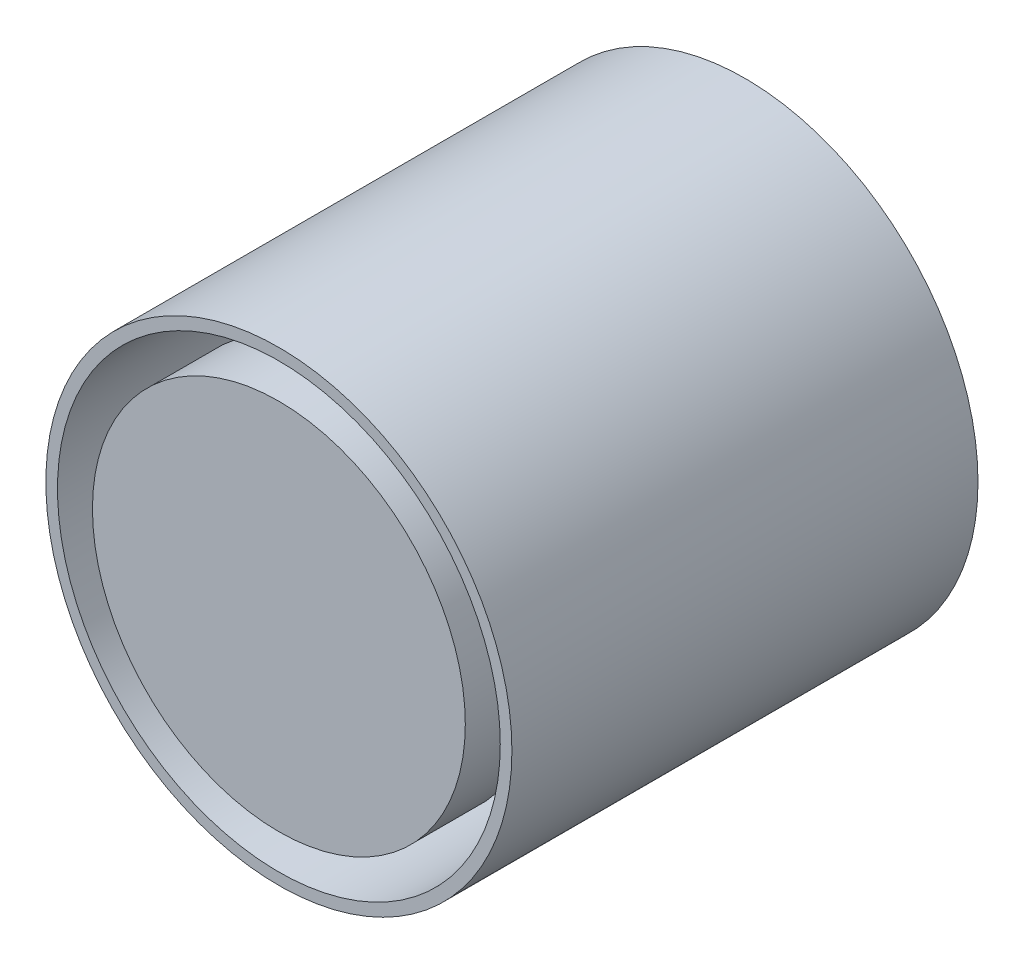
from build123d import *

# Parameters (mm, degrees)
SKETCH_2_R          = 100
EXTRUDE_2_DEPTH     = 200
SKETCH_3_R          = 95
CUT_EXTRUDE_1_DEPTH = 400
SKETCH_4_R          = 80
EXTRUDE_3_DEPTH     = 30


with BuildPart() as part:
    # 草图2 → 凸台-拉伸2 (new body)
    with BuildSketch(Plane.XY):
        Circle(SKETCH_2_R)
    extrude(amount=EXTRUDE_2_DEPTH)

    # 草图3 → 切除-拉伸1 (cut)
    with BuildSketch(Plane.XY.offset(200)):
        Circle(SKETCH_3_R)
    extrude(amount=-CUT_EXTRUDE_1_DEPTH, mode=Mode.SUBTRACT)


with BuildPart() as body_2:
    # 草图4 → 凸台-拉伸3 (new body)
    with BuildSketch(Plane(origin=(0, 0, 0), x_dir=(-1, 0, 0), z_dir=(0, 0, -1))):
        Circle(SKETCH_4_R)
    extrude(amount=-EXTRUDE_3_DEPTH)


with BuildPart() as body_2_1:
    # Move Body 3: moved
    add(body_2.part.moved(Location((0, 0, 170))))


solid = Compound([part.part, body_2_1.part])
